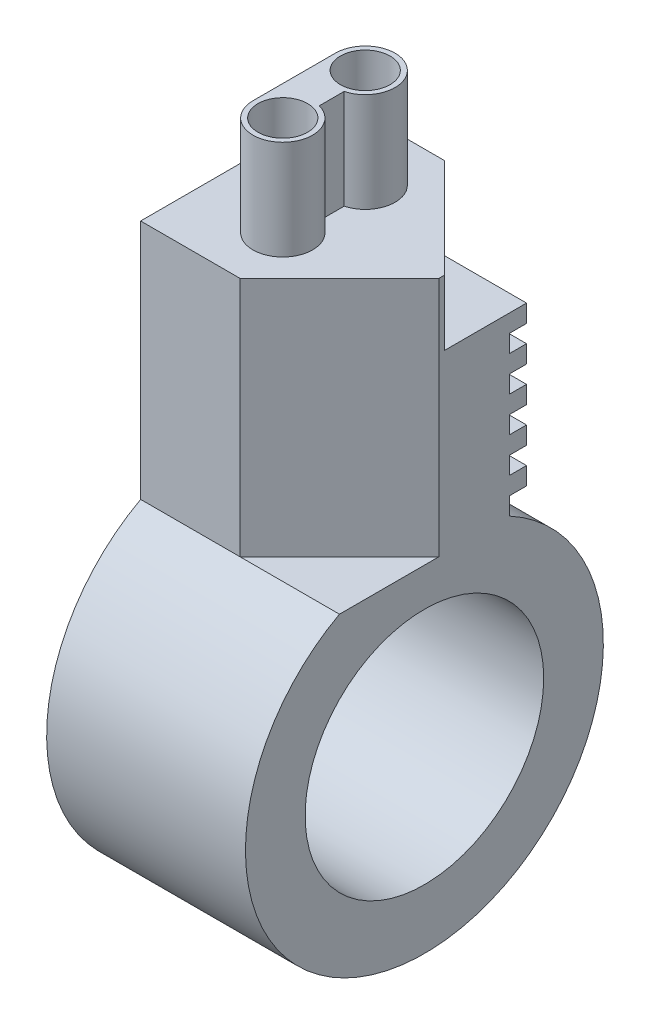
from build123d import *

# Parameters (mm, degrees)
SKETCH1_R           = 6
BOSS_EXTRUDE1_DEPTH = 10
CUT_EXTRUDE1_REACH  = 34.013
CUT_EXTRUDE2_START  = -12.127591
CUT_EXTRUDE2_DEPTH  = 8.847142
BOSS_EXTRUDE7_DEPTH = 5
SKETCH3_R           = 1.25
CUT_EXTRUDE3_DEPTH  = 5
SKETCH3_2_R         = 1.25
CUT_EXTRUDE4_DEPTH  = 11.819305932


with BuildPart() as part:
    # Sketch1 → Boss-Extrude1 (new body)
    with BuildSketch(Plane(origin=(0, 0, 0), x_dir=(0, 0, -1), z_dir=(1, 0, 0))):
        with BuildLine():
            Line((-4.273163423, 7.920863233), (-4.273163423, 20.04845395))
            Line((-4.273163423, 20.04845395), (6, 20.04845395))
            Line((6, 20.04845395), (6, 17.649323049))
            Line((6, 17.649323049), (4.273163423, 17.649323049))
            Line((4.273163423, 17.649323049), (4.273163423, 16.76800454))
            Line((4.273163423, 16.76800454), (5.136581711, 16.76800454))
            Line((5.136581711, 16.76800454), (5.136581711, 15.879894787))
            Line((5.136581711, 15.879894787), (4.273163423, 15.879894787))
            Line((4.273163423, 15.879894787), (4.273163423, 14.998576279))
            Line((4.273163423, 14.998576279), (5.136581711, 14.998576279))
            Line((5.136581711, 14.998576279), (5.136581711, 14.110466526))
            Line((5.136581711, 14.110466526), (4.273163423, 14.110466526))
            Line((4.273163423, 14.110466526), (4.273163423, 13.229148017))
            Line((4.273163423, 13.229148017), (5.136581711, 13.229148017))
            Line((5.136581711, 13.229148017), (5.136581711, 12.341038265))
            Line((5.136581711, 12.341038265), (4.273163423, 12.341038265))
            Line((4.273163423, 12.341038265), (4.273163423, 11.459719756))
            Line((4.273163423, 11.459719756), (5.136581711, 11.459719756))
            Line((5.136581711, 11.459719756), (5.136581711, 10.571610003))
            Line((5.136581711, 10.571610003), (4.273163423, 10.571610003))
            Line((4.273163423, 10.571610003), (4.273163423, 9.690291495))
            Line((4.273163423, 9.690291495), (5.136581711, 9.690291495))
            Line((5.136581711, 9.690291495), (5.136581711, 8.802181742))
            Line((5.136581711, 8.802181742), (4.273163423, 8.802181742))
            Line((4.273163423, 8.802181742), (4.273163423, 7.920863233))
            ThreePointArc((4.273163423, 7.920863233), (0, -9), (-4.273163423, 7.920863233))
        make_face()
        Circle(SKETCH1_R, mode=Mode.SUBTRACT)
    extrude(amount=BOSS_EXTRUDE1_DEPTH)

    # Cut-Extrude1: up to this face of the body (flat: up to its plane)
    cut_extrude1_end = Plane(part.part.faces().sort_by_distance((5, 16.76800454, -4.704872567))[0])
    # Sketch2 → Cut-Extrude1 (cut, up to the picked face)
    with BuildSketch(Plane(origin=(0, 20.04845395, 0), x_dir=(1, 0, 0), z_dir=(0, 1, 0)), mode=Mode.PRIVATE) as cut_extrude1_sk1:
        Polygon((10, 6), (5, 6), (10, 1), align=None)
    cut_extrude1_tool1 = split(extrude(cut_extrude1_sk1.sketch, amount=-CUT_EXTRUDE1_REACH, mode=Mode.PRIVATE), bisect_by=cut_extrude1_end, keep=Keep.BOTH, mode=Mode.PRIVATE)
    # Sketch2 → Cut-Extrude1 (cut, up to the picked face)
    with BuildSketch(Plane(origin=(0, 20.04845395, 0), x_dir=(1, 0, 0), z_dir=(0, 1, 0)), mode=Mode.PRIVATE) as cut_extrude1_sk2:
        Polygon((10, -4.273163423), (10, 0.726836577), (5, -4.273163423), align=None)
    cut_extrude1_tool2 = split(extrude(cut_extrude1_sk2.sketch, amount=-CUT_EXTRUDE1_REACH, mode=Mode.PRIVATE), bisect_by=cut_extrude1_end, keep=Keep.BOTH, mode=Mode.PRIVATE)
    add(cut_extrude1_tool1.solids().sort_by(Axis((8.333333, 20.048454, -4.333333), (0, -1, 0)))[0], mode=Mode.SUBTRACT)
    add(cut_extrude1_tool2.solids().sort_by(Axis((8.333333, 20.048454, 2.606497), (0, -1, 0)))[0], mode=Mode.SUBTRACT)

    # Sketch2<5> → Cut-Extrude2 (cut)
    with BuildSketch(Plane(origin=(0, 20.04845395, 0), x_dir=(1, 0, 0), z_dir=(0, 1, 0)).offset(CUT_EXTRUDE2_START)):
        Polygon((10, -4.273163423), (10, 0.726836577), (5, -4.273163423), align=None)
    extrude(amount=CUT_EXTRUDE2_DEPTH, mode=Mode.SUBTRACT)

    # Sketch2<6> → Boss-Extrude7 (add)
    with BuildSketch(Plane(origin=(0, 20.04845395, 0), x_dir=(1, 0, 0), z_dir=(0, 1, 0))):
        with BuildLine():
            Line((2.586901632, 2.936824491), (2.586901632, -1.209987914))
            ThreePointArc((2.586901632, -1.209987914), (5, -2.400051514), (4.475236793, 0.238872259))
            Line((4.475236793, 0.238872259), (4.475236793, 1.487964318))
            ThreePointArc((4.475236793, 1.487964318), (5, 4.126888091), (2.586901632, 2.936824491))
        make_face()
    extrude(amount=BOSS_EXTRUDE7_DEPTH)

    # Sketch3 → Cut-Extrude3 (cut)
    with BuildSketch(Plane(origin=(0, 25.04845395, 0), x_dir=(1, 0, 0), z_dir=(0, 1, 0))):
        with Locations(Location((4.086901632, 2.936824491, 0), (0, 0, 270))):
            Circle(SKETCH3_R)
        with Locations(Location((4.086901632, -1.209987914, 0), (0, 0, 270))):
            Circle(SKETCH3_R)
    extrude(amount=-CUT_EXTRUDE3_DEPTH, mode=Mode.SUBTRACT)

    # Sketch3<2> → Cut-Extrude4 (cut)
    with BuildSketch(Plane(origin=(0, 25.04845395, 0), x_dir=(1, 0, 0), z_dir=(0, 1, 0))):
        with Locations(Location((4.086901632, 2.936824491, 0), (0, 0, 270))):
            Circle(SKETCH3_2_R)
        with Locations(Location((4.086901632, -1.209987914, 0), (0, 0, 270))):
            Circle(SKETCH3_2_R)
    extrude(amount=-CUT_EXTRUDE4_DEPTH, mode=Mode.SUBTRACT)


solid = part.part
